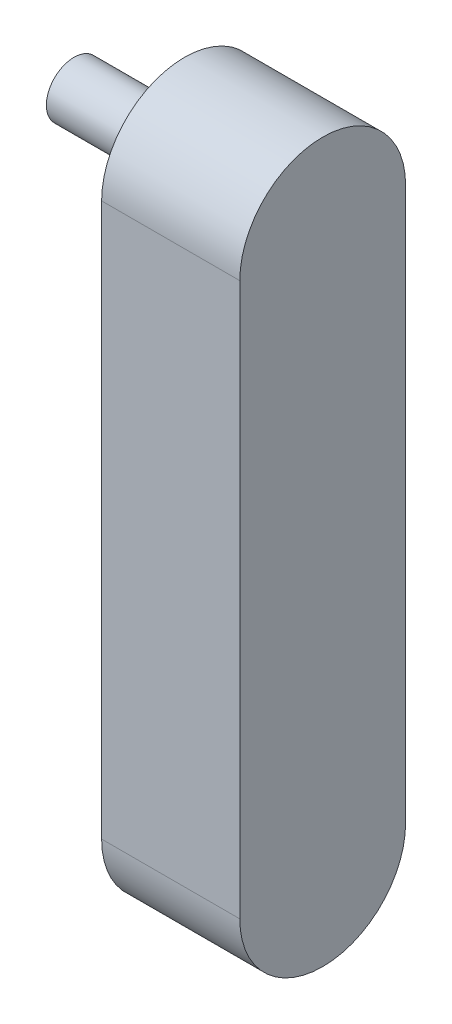
from build123d import *

# Parameters (mm, degrees)
BOSS_EXTRUDE1_DEPTH = 63.5
SKETCH2_R           = 13.97
CUT_EXTRUDE1_DEPTH  = 48.26
SKETCH3_R           = 12.7
BOSS_EXTRUDE2_DEPTH = 50.8


with BuildPart() as part:
    # Sketch1 → Boss-Extrude1 (new body)
    with BuildSketch(Plane(origin=(0, 0, 0), x_dir=(0, 0, -1), z_dir=(1, 0, 0))):
        with BuildLine():
            Line((38.1, 127), (38.1, -127))
            ThreePointArc((38.1, -127), (0, -165.1), (-38.1, -127))
            Line((-38.1, -127), (-38.1, 127))
            ThreePointArc((-38.1, 127), (0, 165.1), (38.1, 127))
        make_face()
    extrude(amount=BOSS_EXTRUDE1_DEPTH)

    # Sketch2 → Cut-Extrude1 (cut)
    with BuildSketch(Plane(origin=(0, 0, 0), x_dir=(0, 0, -1), z_dir=(1, 0, 0))):
        with Locations(Location((0, -127, 0), (0, 0, 180))):
            Circle(SKETCH2_R)
    extrude(amount=CUT_EXTRUDE1_DEPTH, mode=Mode.SUBTRACT)

    # Sketch3 → Boss-Extrude2 (add)
    with BuildSketch(Plane(origin=(0, 0, 0), x_dir=(0, 0, -1), z_dir=(1, 0, 0))):
        with Locations((0, 127)):
            Circle(SKETCH3_R)
    extrude(amount=-BOSS_EXTRUDE2_DEPTH)


solid = part.part
